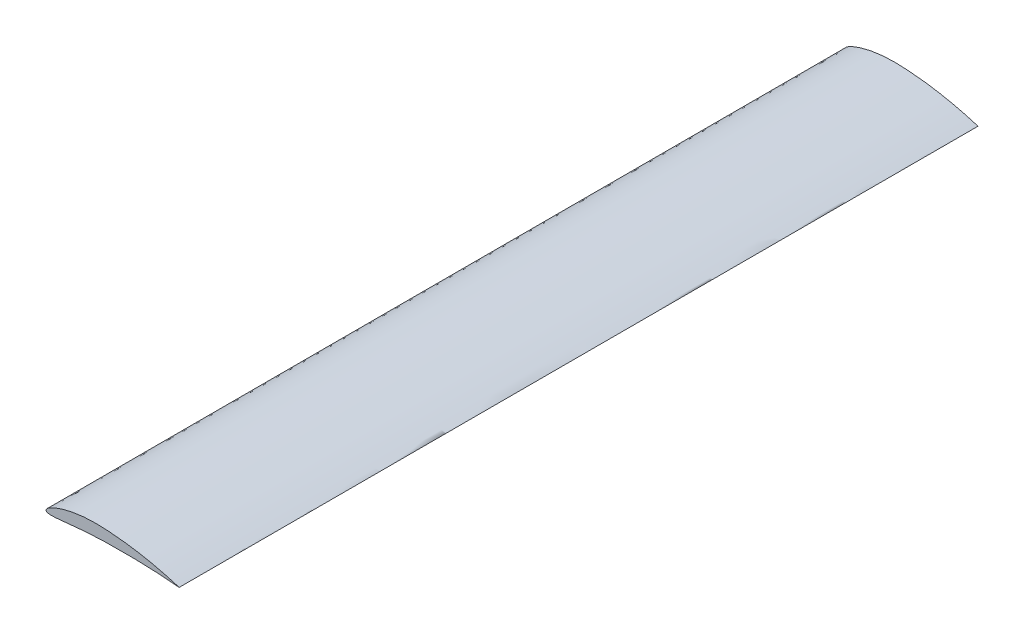
from build123d import *

# Parameters (mm, degrees)
BOSS_EXTRUDE1_DEPTH = 1371.6


with BuildPart() as part:
    # Sketch1 → Boss-Extrude1 (new body)
    with BuildSketch(Plane.XY):
        with BuildLine():
            add(Edge.make_bspline(
                [(304.8, 0), (304.805073835, 0.022345268), (303.481699082, 0.379318261), (302.145524331, 0.848466215), (298.844611234, 1.823536607), (294.771260673, 3.04463063), (289.403610922, 4.579678715), (283.019296887, 6.330758929), (275.600696272, 8.260434129), (267.246213077, 10.292963721), (258.039148325, 12.376006515), (248.071437392, 14.437090383), (237.451680251, 16.418894856), (226.291557935, 18.260748325), (214.711374976, 19.908706419), (202.838786211, 21.317543029), (190.806137406, 22.447996453), (178.744937721, 23.253653254), (166.72878783, 23.766681285), (154.885256787, 23.772129988), (143.373669303, 23.164671512), (132.403352582, 22.028182719), (122.115548216, 20.417487681), (112.6400635, 18.415534133), (104.089600043, 16.125826104), (96.566455996, 13.647808416), (90.147696225, 11.103350359), (84.904778797, 8.577029124), (80.854030962, 6.197370217), (78.046553367, 3.982664517), (76.329619419, 2.038558574), (75.92498098, -0.080044282), (77.413903983, -1.63139365), (79.877346854, -2.333840848), (83.355375502, -2.744283383), (87.916743768, -2.763510085), (93.515787398, -2.482121304), (100.09630686, -1.920543783), (107.582782406, -1.152142221), (115.89898959, -0.243411782), (124.956384486, 0.73705321), (134.673091918, 1.708133725), (144.955523614, 2.58495096), (155.715305743, 3.309093629), (166.916509217, 3.788832183), (178.454355982, 4.057722925), (190.205787255, 4.296997628), (201.986839642, 4.418516651), (213.665061962, 4.430864608), (225.114770388, 4.319625625), (236.210849268, 4.093032461), (246.831288505, 3.760036865), (256.857808238, 3.343909871), (266.176761031, 2.864671907), (274.677370216, 2.355483264), (282.269488448, 1.838755013), (288.833821998, 1.352503507), (294.376832898, 0.905545819), (298.602495473, 0.556825305), (302.023292656, 0.232680412), (303.438256175, 0.154943914), (304.794957491, -0.022207309), (304.8, 0)],
                knots=[0, 0, 0, 0, 0.001374553, 0.005484497, 0.012273361, 0.021682196, 0.033580612, 0.047830743, 0.064305953, 0.082777332, 0.103063756, 0.124929017, 0.148149111, 0.172444695, 0.197572106, 0.223268881, 0.249227775, 0.275186209, 0.300900709, 0.326462938, 0.351222485, 0.374905859, 0.397269706, 0.418072414, 0.437079533, 0.454093094, 0.468919632, 0.481391712, 0.491447127, 0.499023571, 0.504293734, 0.507921918, 0.511539686, 0.516780528, 0.52421649, 0.533991629, 0.546033957, 0.560220284, 0.576403357, 0.594370816, 0.613951104, 0.634916885, 0.657088503, 0.68022991, 0.704175481, 0.729090367, 0.754353776, 0.779667752, 0.80476012, 0.829359339, 0.85320871, 0.876041363, 0.897604065, 0.917662212, 0.93596986, 0.952309788, 0.966502759, 0.978350083, 0.987731492, 0.99451092, 0.998633933, 1, 1, 1, 1], degree=3))
        make_face()
    extrude(amount=BOSS_EXTRUDE1_DEPTH)


solid = part.part
